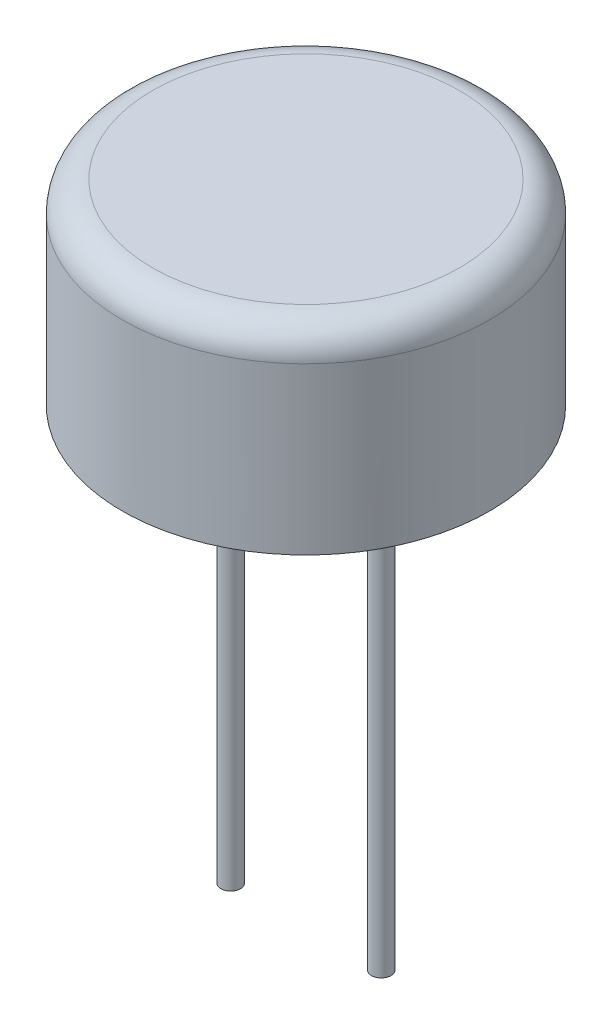
from build123d import *

# Parameters (mm, degrees)
SKETCH2_R           = 6.1
BOSS_EXTRUDE1_DEPTH = 6.5
SKETCH3_R           = 0.325
BOSS_EXTRUDE2_DEPTH = 15
FILLET1_R           = 1


with BuildPart() as part:
    # Sketch2 → Boss-Extrude1 (new body)
    with BuildSketch(Plane(origin=(0, 0, 0), x_dir=(1, 0, 0), z_dir=(0, 1, 0))):
        with Locations(Location((0, 0, 0), (0, 0, 90))):
            Circle(SKETCH2_R)
    extrude(amount=BOSS_EXTRUDE1_DEPTH)

    # Sketch3 → Boss-Extrude2 (add)
    with BuildSketch(Plane.XZ):
        with Locations(Location((-2.5, 0, 0), (0, 0, 90))):
            Circle(SKETCH3_R)
        with Locations(Location((2.5, 0, 0), (0, 0, 90))):
            Circle(SKETCH3_R)
    extrude(amount=BOSS_EXTRUDE2_DEPTH)

    # Fillet1
    fillet1_edges = [part.edges().sort_by_distance(p)[0] for p in [
        (0, 6.5, 6.1),
    ]]
    fillet(fillet1_edges, radius=FILLET1_R)


solid = part.part
